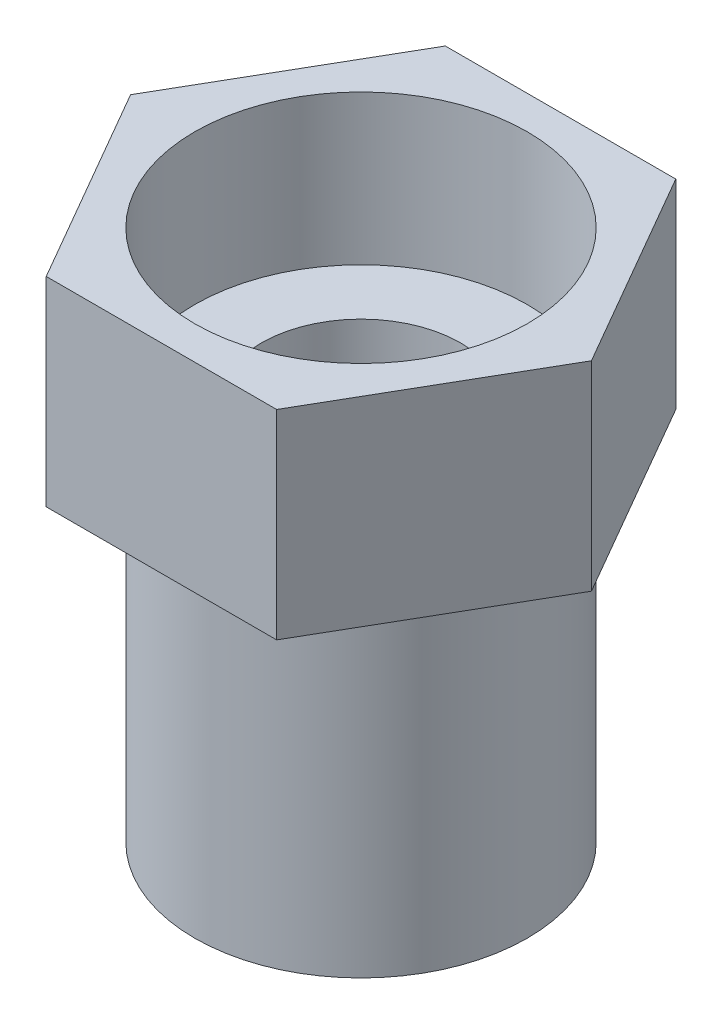
from build123d import *

# Parameters (mm, degrees)
EXTRUDE_1_DEPTH              = 3
SKETCH_2_R                   = 5
EXTRUDE_2_DEPTH              = 10
HOLE_WIZARD_M4_1_D           = 6
HOLE_WIZARD_M4_1_CBORE_D     = 10
HOLE_WIZARD_M4_1_CBORE_DEPTH = 4.5


with BuildPart() as part:
    # 草图1 → 凸台-拉伸1 (new, symmetric)
    with BuildSketch(Plane(origin=(0, 0, 0), x_dir=(1, 0, 0), z_dir=(0, 1, 0))):
        Polygon((6.92820323, 0), (3.464101615, 6), (-3.464101615, 6), (-6.92820323, 0), (-3.464101615, -6), (3.464101615, -6), align=None)
    extrude(amount=EXTRUDE_1_DEPTH, both=True)

    # 草图2 → 凸台-拉伸2 (add)
    with BuildSketch(Plane.XZ.offset(3)):
        with Locations(Location((0, 0, 0), (0, 0, 90))):
            Circle(SKETCH_2_R)
    extrude(amount=EXTRUDE_2_DEPTH)

    # M4 六角头螺栓的柱形沉头孔1 (through all)
    with Locations(Plane(origin=(0, 3, 0), x_dir=(1, 0, 0), z_dir=(0, 1, 0))):
        with Locations((0, 0)):
            CounterBoreHole(HOLE_WIZARD_M4_1_D / 2, HOLE_WIZARD_M4_1_CBORE_D / 2, HOLE_WIZARD_M4_1_CBORE_DEPTH)


solid = part.part
